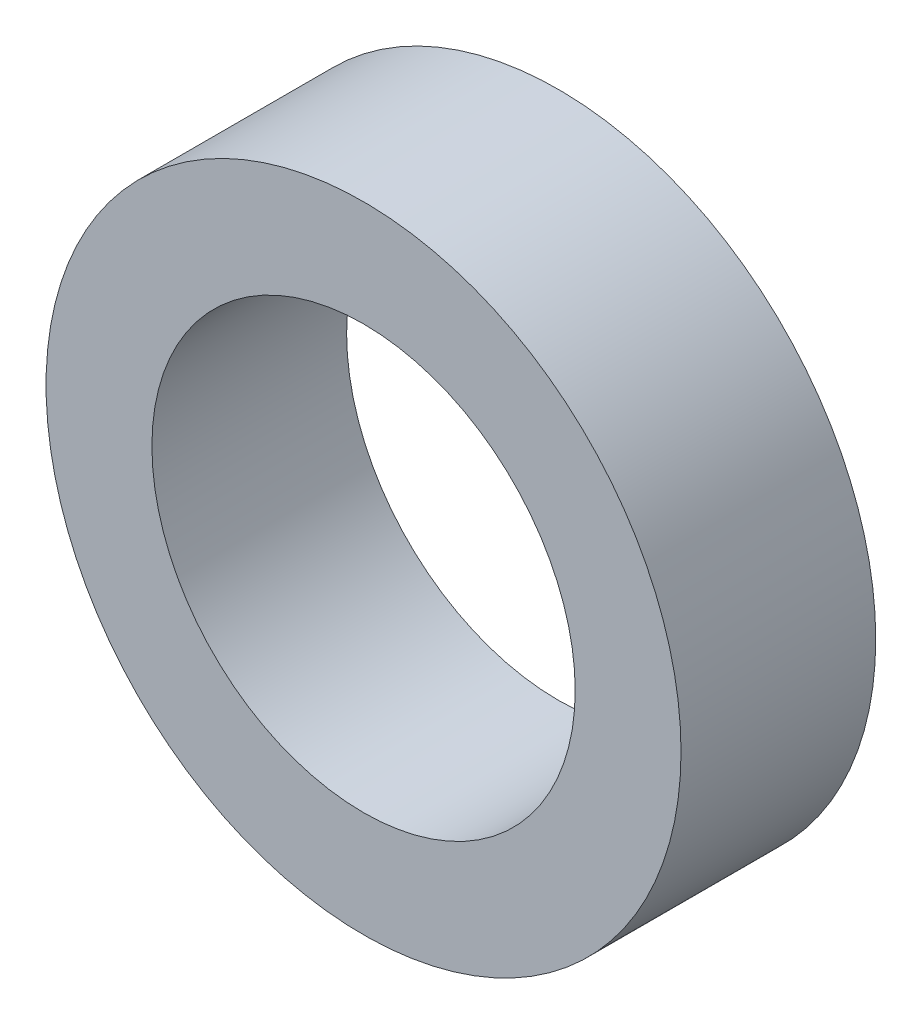
from build123d import *

# Parameters (mm, degrees)
SKETCH1_R           = 37.5
SKETCH1_R_2         = 25
BOSS_EXTRUDE1_DEPTH = 23


with BuildPart() as part:
    # Sketch1 → Boss-Extrude1 (new body)
    with BuildSketch(Plane.XY):
        Circle(SKETCH1_R)
        Circle(SKETCH1_R_2, mode=Mode.SUBTRACT)
    extrude(amount=BOSS_EXTRUDE1_DEPTH)


solid = part.part
